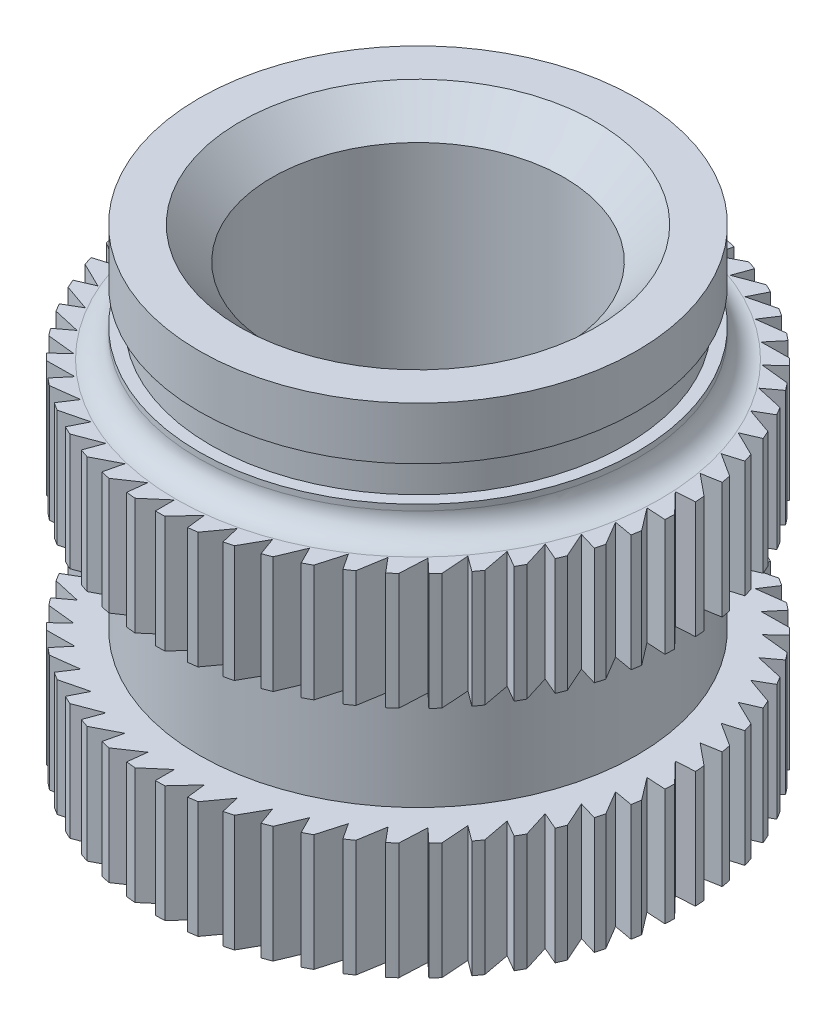
from build123d import *

# Parameters (mm, degrees)
HOLE_WIZARD_M3_1_D           = 2.5
HOLE_WIZARD_M3_1_CSINK_D     = 3.05
HOLE_WIZARD_M3_1_CSINK_ANGLE = 90
FILLET_2_R                   = 0.2
SKETCH_6_R                   = 1.875
SKETCH_6_R_2                 = 1.775
CUT_EXTRUDE_2_DEPTH          = 0.3
CUT_EXTRUDE_START            = -10
CUT_EXTRUDE_1_DEPTH          = 10


with BuildPart() as part:
    # 草图1 → 旋转2 (revolve)
    with BuildSketch(Plane(origin=(0, 0, 0), x_dir=(0, 0, -1), z_dir=(1, 0, 0)), mode=Mode.PRIVATE) as revolve_2_sk:
        Polygon((-1.875, 4), (-1.875, 3), (-2.25, 3), (-2.25, 2), (-1.875, 2), (-1.875, 1), (-2.25, 1), (-2.25, 0), (-0.2, 0), (-0.2, 4), align=None)
    revolve(revolve_2_sk.sketch.rotate(Axis((0, 0, 0), (0, 1, 0)), 180), axis=Axis((0, 0, 0), (0, 1, 0)))

    # M3 螺纹孔1 (through all)
    with Locations(Plane.ZX.offset(4)):
        with Locations((0, 0)):
            CounterSinkHole(HOLE_WIZARD_M3_1_D / 2, HOLE_WIZARD_M3_1_CSINK_D / 2, counter_sink_angle=HOLE_WIZARD_M3_1_CSINK_ANGLE)

    # 圆角2
    fillet_2_edges = [part.edges().sort_by_distance(p)[0] for p in [
        (0, 3, 1.875),
    ]]
    fillet(fillet_2_edges, radius=FILLET_2_R)

    # 草图6 → 切除-拉伸2 (cut)
    with BuildSketch(Plane(origin=(0, 3.25, 0), x_dir=(1, 0, 0), z_dir=(0, 1, 0))):
        with Locations(Location((0, 0, 0), (0, 0, 90))):
            Circle(SKETCH_6_R)
        with Locations(Location((0, 0, 0), (0, 0, 270))):
            Circle(SKETCH_6_R_2, mode=Mode.SUBTRACT)
    extrude(amount=CUT_EXTRUDE_2_DEPTH, mode=Mode.SUBTRACT)

    # 草图5 → 切除-拉伸1 (cut)
    with BuildSketch(Plane(origin=(0, 3, 0), x_dir=(1, 0, 0), z_dir=(0, 1, 0)).offset(CUT_EXTRUDE_START)):
        with BuildLine():
            Line((-0.181748925, -2.242647393), (0, -2.086527402))
            Line((0, -2.086527402), (0, -2.25))
            ThreePointArc((0, -2.25), (-0.090948794, -2.248161097), (-0.181748925, -2.242647393))
        make_face()
        with BuildLine():
            Line((-0.242231047, -2.07241905), (-0.261209057, -2.234786305))
            ThreePointArc((-0.261209057, -2.234786305), (-0.351329404, -2.222401325), (-0.440875475, -2.206383651))
            Line((-0.440875475, -2.206383651), (-0.242231047, -2.07241905))
        make_face()
        with BuildLine():
            Line((-0.481186334, -2.030284786), (-0.518885709, -2.189350959))
            ThreePointArc((-0.518885709, -2.189350959), (-0.606958886, -2.166587388), (-0.69403994, -2.140282356))
            Line((-0.69403994, -2.140282356), (-0.481186334, -2.030284786))
        make_face()
        with BuildLine():
            Line((-0.713634401, -1.960694403), (-0.769545322, -2.114308397))
            ThreePointArc((-0.769545322, -2.114308397), (-0.854380291, -2.081474073), (-0.937818706, -2.045237413))
            Line((-0.937818706, -2.045237413), (-0.713634401, -1.960694403))
        make_face()
        with BuildLine():
            Line((-0.936431788, -1.864588992), (-1.009798155, -2.010673441))
            ThreePointArc((-1.009798155, -2.010673441), (-1.090247668, -1.968212393), (-1.168915083, -1.922534143))
            Line((-1.168915083, -1.922534143), (-0.936431788, -1.864588992))
        make_face()
        with BuildLine():
            Line((-1.14656554, -1.743268213), (-1.236395201, -1.879847576))
            ThreePointArc((-1.236395201, -1.879847576), (-1.311371316, -1.828334016), (-1.384203888, -1.773831896))
            Line((-1.384203888, -1.773831896), (-1.14656554, -1.743268213))
        make_face()
        with BuildLine():
            Line((-1.341193961, -1.598372722), (-1.446272122, -1.723599997))
            ThreePointArc((-1.446272122, -1.723599997), (-1.514760916, -1.663730558), (-1.580773711, -1.601141616))
            Line((-1.580773711, -1.601141616), (-1.341193961, -1.598372722))
        make_face()
        with BuildLine():
            Line((-1.517685035, -1.431861982), (-1.636590694, -1.544043685))
            ThreePointArc((-1.636590694, -1.544043685), (-1.697665973, -1.476627998), (-1.755966281, -1.406798643))
            Line((-1.755966281, -1.406798643), (-1.517685035, -1.431861982))
        make_face()
        with BuildLine():
            Line((-1.673652022, -1.245987765), (-1.804777184, -1.343606831))
            ThreePointArc((-1.804777184, -1.343606831), (-1.85761301, -1.269556578), (-1.907412419, -1.193431131))
            Line((-1.907412419, -1.193431131), (-1.673652022, -1.245987765))
        make_face()
        with BuildLine():
            Line((-1.806985736, -1.043263701), (-1.948557159, -1.125))
            ThreePointArc((-1.948557159, -1.125), (-1.992439019, -1.045316582), (-2.033064076, -0.963924511))
            Line((-2.033064076, -0.963924511), (-1.806985736, -1.043263701))
        make_face()
        with BuildLine():
            Line((-1.915883068, -0.826431285), (-2.06598624, -0.891179474))
            ThreePointArc((-2.06598624, -0.891179474), (-2.100320707, -0.806940474), (-2.13122203, -0.721382465))
            Line((-2.13122203, -0.721382465), (-1.915883068, -0.826431285))
        make_face()
        with BuildLine():
            Line((-1.998871368, -0.598422804), (-2.155476403, -0.645307274))
            ThreePointArc((-2.155476403, -0.645307274), (-2.179799161, -0.55765188), (-2.200558861, -0.469084958))
            Line((-2.200558861, -0.469084958), (-1.998871368, -0.598422804))
        make_face()
        with BuildLine():
            Line((-2.054828363, -0.362321681), (-2.215817444, -0.3907084))
            ThreePointArc((-2.215817444, -0.3907084), (-2.22979957, -0.300822), (-2.240136909, -0.210443883))
            Line((-2.240136909, -0.210443883), (-2.054828363, -0.362321681))
        make_face()
        with BuildLine():
            Line((-2.082997328, -0.121320779), (-2.246193356, -0.130825865))
            ThreePointArc((-2.246193356, -0.130825865), (-2.249645766, -0.039924019), (-2.249420948, 0.051043085))
            Line((-2.249420948, 0.051043085), (-2.082997328, -0.121320779))
        make_face()
        with BuildLine():
            Line((-2.082997328, 0.121320779), (-2.246193356, 0.130825865))
            ThreePointArc((-2.246193356, 0.130825865), (-2.239069362, 0.221513865), (-2.228285428, 0.311839783))
            Line((-2.228285428, 0.311839783), (-2.082997328, 0.121320779))
        make_face()
        with BuildLine():
            Line((-2.054828363, 0.362321681), (-2.215817444, 0.3907084))
            ThreePointArc((-2.215817444, 0.3907084), (-2.198213386, 0.479956155), (-2.17701617, 0.568419383))
            Line((-2.17701617, 0.568419383), (-2.054828363, 0.362321681))
        make_face()
        with BuildLine():
            Line((-1.998871368, 0.598422804), (-2.155476403, 0.645307274))
            ThreePointArc((-2.155476403, 0.645307274), (-2.127630345, 0.731907861), (-2.096306503, 0.817312086))
            Line((-2.096306503, 0.817312086), (-1.998871368, 0.598422804))
        make_face()
        with BuildLine():
            Line((-1.915883068, 0.826431285), (-2.06598624, 0.891179474))
            ThreePointArc((-2.06598624, 0.891179474), (-2.028274753, 0.973961769), (-1.987247887, 1.055152045))
            Line((-1.987247887, 1.055152045), (-1.915883068, 0.826431285))
        make_face()
        with BuildLine():
            Line((-1.806985736, 1.043263701), (-1.948557159, 1.125))
            ThreePointArc((-1.948557159, 1.125), (-1.901490225, 1.202844514), (-1.851315152, 1.278722882))
            Line((-1.851315152, 1.278722882), (-1.806985736, 1.043263701))
        make_face()
        with BuildLine():
            Line((-1.673652022, 1.245987765), (-1.804777184, 1.343606831))
            ThreePointArc((-1.804777184, 1.343606831), (-1.748991303, 1.415460851), (-1.690346555, 1.485001186))
            Line((-1.690346555, 1.485001186), (-1.673652022, 1.245987765))
        make_face()
        with BuildLine():
            Line((-1.517685035, 1.431861982), (-1.636590694, 1.544043685))
            ThreePointArc((-1.636590694, 1.544043685), (-1.572840275, 1.608935509), (-1.506518921, 1.671197397))
            Line((-1.506518921, 1.671197397), (-1.517685035, 1.431861982))
        make_face()
        with BuildLine():
            Line((-1.341193961, 1.598372722), (-1.446272122, 1.723599997))
            ThreePointArc((-1.446272122, 1.723599997), (-1.375419279, 1.780652073), (-1.302318203, 1.83479353))
            Line((-1.302318203, 1.83479353), (-1.341193961, 1.598372722))
        make_face()
        with BuildLine():
            Line((-1.14656554, 1.743268213), (-1.236395201, 1.879847576))
            ThreePointArc((-1.236395201, 1.879847576), (-1.159398098, 1.928288373), (-1.080505866, 1.973577228))
            Line((-1.080505866, 1.973577228), (-1.14656554, 1.743268213))
        make_face()
        with BuildLine():
            Line((-0.936431788, 1.864588992), (-1.009798155, 2.010673441))
            ThreePointArc((-1.009798155, 2.010673441), (-0.927698046, 2.049847881), (-0.84408154, 2.085671679))
            Line((-0.84408154, 2.085671679), (-0.936431788, 1.864588992))
        make_face()
        with BuildLine():
            Line((-0.713634401, 1.960694403), (-0.769545322, 2.114308397))
            ThreePointArc((-0.769545322, 2.114308397), (-0.68345247, 2.143686712), (-0.596242459, 2.169560999))
            Line((-0.596242459, 2.169560999), (-0.713634401, 1.960694403))
        make_face()
        with BuildLine():
            Line((-0.481186334, 2.030284786), (-0.518885709, 2.189350959))
            ThreePointArc((-0.518885709, 2.189350959), (-0.429964372, 2.208535859), (-0.340340222, 2.224110729))
            Line((-0.340340222, 2.224110729), (-0.481186334, 2.030284786))
        make_face()
        with BuildLine():
            Line((-0.242231047, 2.07241905), (-0.261209057, 2.234786305))
            ThreePointArc((-0.261209057, 2.234786305), (-0.170661743, 2.243518346), (-0.079835468, 2.248583176))
            Line((-0.079835468, 2.248583176), (-0.242231047, 2.07241905))
        make_face()
        with BuildLine():
            Line((0, 2.086527402), (0, 2.25))
            ThreePointArc((0, 2.25), (0.090948794, 2.248161097), (0.181748925, 2.242647393))
            Line((0.181748925, 2.242647393), (0, 2.086527402))
        make_face()
        with BuildLine():
            Line((0.242231047, 2.07241905), (0.261209057, 2.234786305))
            ThreePointArc((0.261209057, 2.234786305), (0.351329404, 2.222401325), (0.440875475, 2.206383651))
            Line((0.440875475, 2.206383651), (0.242231047, 2.07241905))
        make_face()
        with BuildLine():
            Line((0.481186334, 2.030284786), (0.518885709, 2.189350959))
            ThreePointArc((0.518885709, 2.189350959), (0.606958886, 2.166587388), (0.69403994, 2.140282356))
            Line((0.69403994, 2.140282356), (0.481186334, 2.030284786))
        make_face()
        with BuildLine():
            Line((0.713634401, 1.960694403), (0.769545322, 2.114308397))
            ThreePointArc((0.769545322, 2.114308397), (0.854380291, 2.081474073), (0.937818706, 2.045237413))
            Line((0.937818706, 2.045237413), (0.713634401, 1.960694403))
        make_face()
        with BuildLine():
            Line((0.936431788, 1.864588992), (1.009798155, 2.010673441))
            ThreePointArc((1.009798155, 2.010673441), (1.090247668, 1.968212393), (1.168915083, 1.922534143))
            Line((1.168915083, 1.922534143), (0.936431788, 1.864588992))
        make_face()
        with BuildLine():
            Line((1.14656554, 1.743268213), (1.236395201, 1.879847576))
            ThreePointArc((1.236395201, 1.879847576), (1.311371316, 1.828334016), (1.384203888, 1.773831896))
            Line((1.384203888, 1.773831896), (1.14656554, 1.743268213))
        make_face()
        with BuildLine():
            Line((1.341193961, 1.598372722), (1.446272122, 1.723599997))
            ThreePointArc((1.446272122, 1.723599997), (1.514760916, 1.663730558), (1.580773711, 1.601141616))
            Line((1.580773711, 1.601141616), (1.341193961, 1.598372722))
        make_face()
        with BuildLine():
            Line((1.517685035, 1.431861982), (1.636590694, 1.544043685))
            ThreePointArc((1.636590694, 1.544043685), (1.697665973, 1.476627998), (1.755966281, 1.406798643))
            Line((1.755966281, 1.406798643), (1.517685035, 1.431861982))
        make_face()
        with BuildLine():
            Line((1.673652022, 1.245987765), (1.804777184, 1.343606831))
            ThreePointArc((1.804777184, 1.343606831), (1.85761301, 1.269556578), (1.907412419, 1.193431131))
            Line((1.907412419, 1.193431131), (1.673652022, 1.245987765))
        make_face()
        with BuildLine():
            Line((1.806985736, 1.043263701), (1.948557159, 1.125))
            ThreePointArc((1.948557159, 1.125), (1.992439019, 1.045316582), (2.033064076, 0.963924511))
            Line((2.033064076, 0.963924511), (1.806985736, 1.043263701))
        make_face()
        with BuildLine():
            Line((1.915883068, 0.826431285), (2.06598624, 0.891179474))
            ThreePointArc((2.06598624, 0.891179474), (2.100320707, 0.806940474), (2.13122203, 0.721382465))
            Line((2.13122203, 0.721382465), (1.915883068, 0.826431285))
        make_face()
        with BuildLine():
            Line((1.998871368, 0.598422804), (2.155476403, 0.645307274))
            ThreePointArc((2.155476403, 0.645307274), (2.179799161, 0.55765188), (2.200558861, 0.469084958))
            Line((2.200558861, 0.469084958), (1.998871368, 0.598422804))
        make_face()
        with BuildLine():
            Line((2.054828363, 0.362321681), (2.215817444, 0.3907084))
            ThreePointArc((2.215817444, 0.3907084), (2.22979957, 0.300822), (2.240136909, 0.210443883))
            Line((2.240136909, 0.210443883), (2.054828363, 0.362321681))
        make_face()
        with BuildLine():
            Line((2.082997328, 0.121320779), (2.246193356, 0.130825865))
            ThreePointArc((2.246193356, 0.130825865), (2.249645766, 0.039924019), (2.249420948, -0.051043085))
            Line((2.249420948, -0.051043085), (2.082997328, 0.121320779))
        make_face()
        with BuildLine():
            Line((2.082997328, -0.121320779), (2.246193356, -0.130825865))
            ThreePointArc((2.246193356, -0.130825865), (2.239069362, -0.221513865), (2.228285428, -0.311839783))
            Line((2.228285428, -0.311839783), (2.082997328, -0.121320779))
        make_face()
        with BuildLine():
            Line((2.054828363, -0.362321681), (2.215817444, -0.3907084))
            ThreePointArc((2.215817444, -0.3907084), (2.198213386, -0.479956155), (2.17701617, -0.568419383))
            Line((2.17701617, -0.568419383), (2.054828363, -0.362321681))
        make_face()
        with BuildLine():
            Line((1.998871368, -0.598422804), (2.155476403, -0.645307274))
            ThreePointArc((2.155476403, -0.645307274), (2.127630345, -0.731907861), (2.096306503, -0.817312086))
            Line((2.096306503, -0.817312086), (1.998871368, -0.598422804))
        make_face()
        with BuildLine():
            Line((1.915883068, -0.826431285), (2.06598624, -0.891179474))
            ThreePointArc((2.06598624, -0.891179474), (2.028274753, -0.973961769), (1.987247887, -1.055152045))
            Line((1.987247887, -1.055152045), (1.915883068, -0.826431285))
        make_face()
        with BuildLine():
            Line((1.806985736, -1.043263701), (1.948557159, -1.125))
            ThreePointArc((1.948557159, -1.125), (1.901490225, -1.202844514), (1.851315152, -1.278722882))
            Line((1.851315152, -1.278722882), (1.806985736, -1.043263701))
        make_face()
        with BuildLine():
            Line((1.673652022, -1.245987765), (1.804777184, -1.343606831))
            ThreePointArc((1.804777184, -1.343606831), (1.748991303, -1.415460851), (1.690346555, -1.485001186))
            Line((1.690346555, -1.485001186), (1.673652022, -1.245987765))
        make_face()
        with BuildLine():
            Line((1.517685035, -1.431861982), (1.636590694, -1.544043685))
            ThreePointArc((1.636590694, -1.544043685), (1.572840275, -1.608935509), (1.506518921, -1.671197397))
            Line((1.506518921, -1.671197397), (1.517685035, -1.431861982))
        make_face()
        with BuildLine():
            Line((1.341193961, -1.598372722), (1.446272122, -1.723599997))
            ThreePointArc((1.446272122, -1.723599997), (1.375419279, -1.780652073), (1.302318203, -1.83479353))
            Line((1.302318203, -1.83479353), (1.341193961, -1.598372722))
        make_face()
        with BuildLine():
            Line((1.14656554, -1.743268213), (1.236395201, -1.879847576))
            ThreePointArc((1.236395201, -1.879847576), (1.159398098, -1.928288373), (1.080505866, -1.973577228))
            Line((1.080505866, -1.973577228), (1.14656554, -1.743268213))
        make_face()
        with BuildLine():
            Line((0.936431788, -1.864588992), (1.009798155, -2.010673441))
            ThreePointArc((1.009798155, -2.010673441), (0.927698046, -2.049847881), (0.84408154, -2.085671679))
            Line((0.84408154, -2.085671679), (0.936431788, -1.864588992))
        make_face()
        with BuildLine():
            Line((0.713634401, -1.960694403), (0.769545322, -2.114308397))
            ThreePointArc((0.769545322, -2.114308397), (0.68345247, -2.143686712), (0.596242459, -2.169560999))
            Line((0.596242459, -2.169560999), (0.713634401, -1.960694403))
        make_face()
        with BuildLine():
            Line((0.481186334, -2.030284786), (0.518885709, -2.189350959))
            ThreePointArc((0.518885709, -2.189350959), (0.429964372, -2.208535859), (0.340340222, -2.224110729))
            Line((0.340340222, -2.224110729), (0.481186334, -2.030284786))
        make_face()
        with BuildLine():
            Line((0.242231047, -2.07241905), (0.261209057, -2.234786305))
            ThreePointArc((0.261209057, -2.234786305), (0.170661743, -2.243518346), (0.079835468, -2.248583176))
            Line((0.079835468, -2.248583176), (0.242231047, -2.07241905))
        make_face()
    extrude(amount=CUT_EXTRUDE_1_DEPTH, mode=Mode.SUBTRACT)


solid = part.part
